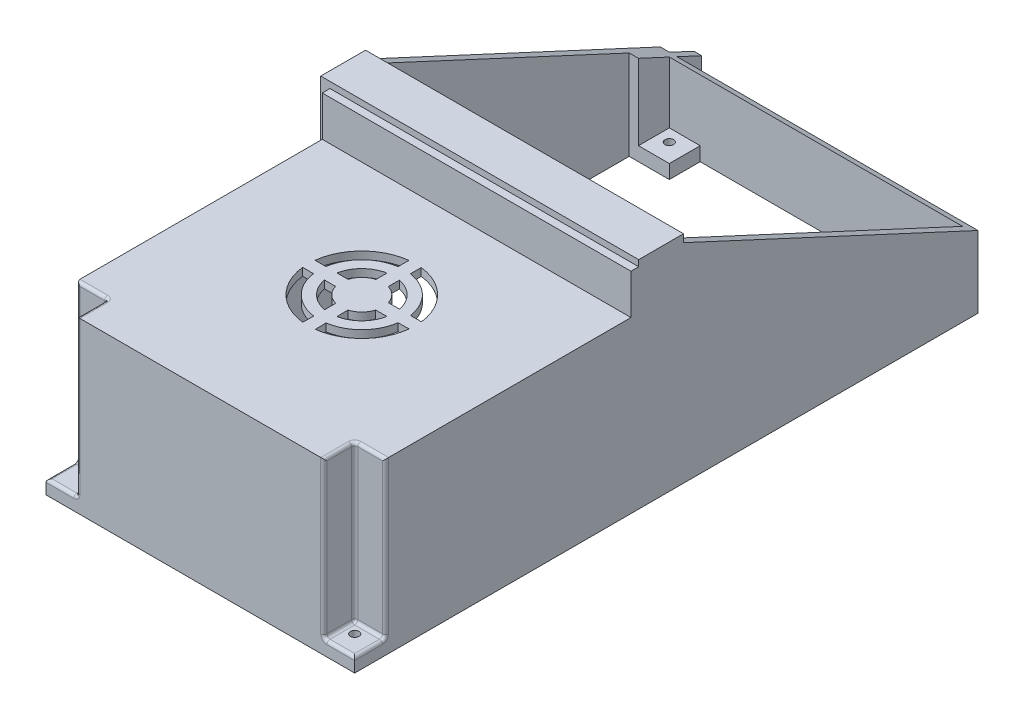
from build123d import *

# Parameters (mm, degrees)
BOSS_EXTRUDE1_DEPTH     = 67.5
CUT_EXTRUDE1_DEPTH      = 243.123064516
CUT_EXTRUDE1_DEPTH_BACK = 243.123064516
SKETCH3_W               = 10
SKETCH3_H               = 10
CUT_EXTRUDE2_DEPTH      = 63
SKETCH13_W              = 105.444668515
SKETCH13_H              = 94.744573391
CUT_EXTRUDE7_DEPTH      = 15
SKETCH7_R               = 1.4
CUT_EXTRUDE3_DEPTH      = 2.5
BOSS_EXTRUDE3_DEPTH     = 2.5
FILLET1_R               = 1
CUT_EXTRUDE4_DEPTH      = 2.5
SKETCH9_R               = 3
SKETCH9_R_2             = 1.4
BOSS_EXTRUDE4_DEPTH     = 4
SKETCH14_W              = 103
SKETCH14_H              = 14.520068356
BOSS_EXTRUDE5_DEPTH     = 2.5
SKETCH15_W              = 100
SKETCH15_H              = 13
BOSS_EXTRUDE6_DEPTH     = 2.5


with BuildPart() as part:
    # Sketch1 → Boss-Extrude1 (new body)
    with BuildSketch(Plane(origin=(0, 0, 0), x_dir=(1, 0, 0), z_dir=(0, 1, 0))):
        Polygon((0, 0), (100, 0), (100, 201.922195993), (97.5, 201.922195993), (2.5, 201.922195993), (2.5, 209.922195993), (0, 209.922195993), (0, 202), (-3, 202), (-3, 92), (0, 92), align=None)
        Polygon((87.5, 199.422195993), (12.5, 199.422195993), (12.5, 189.422195993), (2.5, 189.422195993), (-0.5, 189.422195993), (-0.5, 94.5), (2.5, 94.5), (2.5, 12.5), (12.5, 12.5), (12.5, 2.5), (87.5, 2.5), (87.5, 12.5), (97.5, 12.5), (97.5, 189.422195993), (87.5, 189.422195993), align=None, mode=Mode.SUBTRACT)
    extrude(amount=BOSS_EXTRUDE1_DEPTH)

    # Sketch2 → Cut-Extrude1 (cut, two sides: drawn at the far end of the back side and taken through both)
    with BuildSketch(Plane(origin=(0, 0, 0), x_dir=(0, 0, -1), z_dir=(1, 0, 0)).offset(-CUT_EXTRUDE1_DEPTH_BACK)):
        Polygon((209.922195993, 19.5), (106.520068356, 67.5), (209.922195993, 67.5), align=None)
    extrude(amount=CUT_EXTRUDE1_DEPTH + CUT_EXTRUDE1_DEPTH_BACK, mode=Mode.SUBTRACT)

    # Sketch3 → Cut-Extrude2 (cut)
    with BuildSketch(Plane(origin=(0, 67.5, 0), x_dir=(1, 0, 0), z_dir=(0, 1, 0))):
        with Locations((5, 5)):
            Rectangle(SKETCH3_W, SKETCH3_H)
        with Locations((95, 5)):
            Rectangle(SKETCH3_W, SKETCH3_H)
        with Locations((92.5, 194.422195993)):
            Rectangle(SKETCH3_W, SKETCH3_H)
        with Locations((7.5, 194.422195993)):
            Rectangle(SKETCH3_W, SKETCH3_H)
    extrude(amount=-CUT_EXTRUDE2_DEPTH, mode=Mode.SUBTRACT)

    # Sketch13 → Cut-Extrude7 (cut)
    with BuildSketch(Plane(origin=(0, 67.5, 0), x_dir=(1, 0, 0), z_dir=(0, 1, 0))):
        with Locations((49.722334258, 44.627713304)):
            Rectangle(SKETCH13_W, SKETCH13_H)
    extrude(amount=-CUT_EXTRUDE7_DEPTH, mode=Mode.SUBTRACT)

    # Sketch7 → Cut-Extrude3 (cut)
    with BuildSketch(Plane(origin=(0, 4.5, 0), x_dir=(1, 0, 0), z_dir=(0, 1, 0))):
        with Locations(Location((6.5, 6.5, 0), (0, 0, 270))):
            Circle(SKETCH7_R)
        with Locations(Location((93.5, 6.5, 0), (0, 0, 270))):
            Circle(SKETCH7_R)
        with Locations(Location((93.5, 195.422195993, 0), (0, 0, 270))):
            Circle(SKETCH7_R)
        with Locations(Location((6.5, 195.422195993, 0), (0, 0, 270))):
            Circle(SKETCH7_R)
    extrude(amount=-CUT_EXTRUDE3_DEPTH, mode=Mode.SUBTRACT)

    # Sketch6 → Boss-Extrude3 (add)
    with BuildSketch(Plane(origin=(0, 52.5, 0), x_dir=(1, 0, 0), z_dir=(0, 1, 0))):
        Polygon((0, 10), (10, 10), (10, 0), (90, 0), (90, 10), (100, 10), (100, 92), (0, 92), align=None)
    extrude(amount=BOSS_EXTRUDE3_DEPTH)

    # Fillet1
    fillet1_edges = [part.edges().sort_by_distance(p)[0] for p in [
        (100, 4.5, -5),
        (100, 29.75, -10),
        (95, 4.5, 0),
        (90, 4.5, -5),
        (90, 29.75, 0),
        (95, 4.5, -10),
        (90, 29.75, -10),
        (0, 4.5, -5),
        (5, 4.5, -10),
        (0, 29.75, -10),
        (10, 4.5, -5),
        (10, 29.75, -10),
        (5, 4.5, 0),
        (10, 29.75, 0),
        (5, 55, -10),
        (10, 55, -5),
        (90, 55, -5),
        (95, 55, -10),
    ]]
    fillet(fillet1_edges, radius=FILLET1_R)

    # Sketch8 → Cut-Extrude4 (cut)
    with BuildSketch(Plane(origin=(0, 55, 0), x_dir=(1, 0, 0), z_dir=(0, 1, 0))):
        with BuildLine():
            Line((48, 66.030478743), (48, 69.559887757))
            ThreePointArc((48, 69.559887757), (37.747494154, 64.619743351), (32.751630891, 54.394272549))
            Line((32.751630891, 54.394272549), (36.283905916, 54.394272549))
            ThreePointArc((36.283905916, 54.394272549), (40.222514282, 62.144992148), (48, 66.030478743))
        make_face()
        with BuildLine():
            ThreePointArc((67.250508789, 54.376571097), (62.258779803, 64.613500264), (51.999872379, 69.559902545))
            Line((51.999872379, 69.559902545), (51.995972434, 66.031064817))
            ThreePointArc((51.995972434, 66.031064817), (59.782392543, 62.140116351), (63.718784694, 54.376571097))
            Line((63.718784694, 54.376571097), (67.250508789, 54.376571097))
        make_face()
        with BuildLine():
            ThreePointArc((52.172784101, 35.061770682), (62.371552974, 40.10057205), (67.267297082, 50.368780042))
            Line((67.267297082, 50.368780042), (63.734353685, 50.329807549))
            ThreePointArc((63.734353685, 50.329807549), (59.869305567, 42.547819197), (52.133858688, 38.590446171))
            Line((52.133858688, 38.590446171), (52.172784101, 35.061770682))
        make_face()
        with BuildLine():
            Line((36.256551333, 50.394272549), (32.729870259, 50.394272549))
            ThreePointArc((32.729870259, 50.394272549), (37.744451644, 39.98404241), (48.179365496, 35.021030128))
            Line((48.179365496, 35.021030128), (48.179365496, 38.545347156))
            ThreePointArc((48.179365496, 38.545347156), (40.219436137, 42.45882498), (36.256551333, 50.394272549))
        make_face()
        with BuildLine():
            Line((43.394518847, 50.394272549), (39.801599083, 50.394272549))
            ThreePointArc((39.801599083, 50.394272549), (42.694550048, 44.933492377), (48.179365496, 42.086373682))
            Line((48.179365496, 42.086373682), (48.179365496, 45.670830881))
            ThreePointArc((48.179365496, 45.670830881), (45.170136486, 47.407727524), (43.394518847, 50.394272549))
        make_face()
        with BuildLine():
            Line((48, 58.878040566), (48, 62.480783478))
            ThreePointArc((48, 62.480783478), (42.6977071, 59.670396021), (39.838492389, 54.394272549))
            Line((39.838492389, 54.394272549), (43.451623336, 54.394272549))
            ThreePointArc((43.451623336, 54.394272549), (45.173538583, 57.196387596), (48, 58.878040566))
        make_face()
        with BuildLine():
            ThreePointArc((60.165139128, 54.376571097), (57.30583297, 59.666886795), (51.992050513, 62.482341979))
            Line((51.992050513, 62.482341979), (51.988071163, 58.881655832))
            ThreePointArc((51.988071163, 58.881655832), (54.828637163, 57.194241801), (56.554010489, 54.376571097))
            Line((56.554010489, 54.376571097), (60.165139128, 54.376571097))
        make_face()
        with BuildLine():
            ThreePointArc((52.094713542, 42.139041005), (57.366796475, 44.994838139), (60.178474304, 50.290582046))
            Line((60.178474304, 50.290582046), (56.56234759, 50.250691943))
            ThreePointArc((56.56234759, 50.250691943), (54.863324523, 47.440986584), (52.054994158, 45.739691738))
            Line((52.054994158, 45.739691738), (52.094713542, 42.139041005))
        make_face()
    extrude(amount=-CUT_EXTRUDE4_DEPTH, mode=Mode.SUBTRACT)

    # Sketch9 → Boss-Extrude4 (add)
    # profile 1 of 2: a face of its own
    with BuildSketch(Plane.XZ.offset(-52.5)):
        with Locations(Location((34.040847972, -36.263045043, 0), (0, 0, 90))):
            Circle(SKETCH9_R)
        with Locations(Location((34.040847972, -36.263045043, 0), (0, 0, 270))):
            Circle(SKETCH9_R_2, mode=Mode.SUBTRACT)
    # profile 2 of 2: a face of its own
    with BuildSketch(Plane.XZ.offset(-52.5)):
        with Locations(Location((65.962383475, -68.334497632, 0), (0, 0, 90))):
            Circle(SKETCH9_R)
        with Locations(Location((65.962383475, -68.334497632, 0), (0, 0, 270))):
            Circle(SKETCH9_R_2, mode=Mode.SUBTRACT)
    extrude(amount=BOSS_EXTRUDE4_DEPTH)

    # Sketch14 → Boss-Extrude5 (add)
    with BuildSketch(Plane(origin=(0, 67.5, 0), x_dir=(1, 0, 0), z_dir=(0, 1, 0))):
        with Locations((48.5, 99.260034178)):
            Rectangle(SKETCH14_W, SKETCH14_H)
    extrude(amount=BOSS_EXTRUDE5_DEPTH)

    # Sketch15 → Boss-Extrude6 (add)
    with BuildSketch(Plane.XY.offset(-92)):
        with Locations((50, 61.5)):
            Rectangle(SKETCH15_W, SKETCH15_H)
    extrude(amount=BOSS_EXTRUDE6_DEPTH)


solid = part.part
